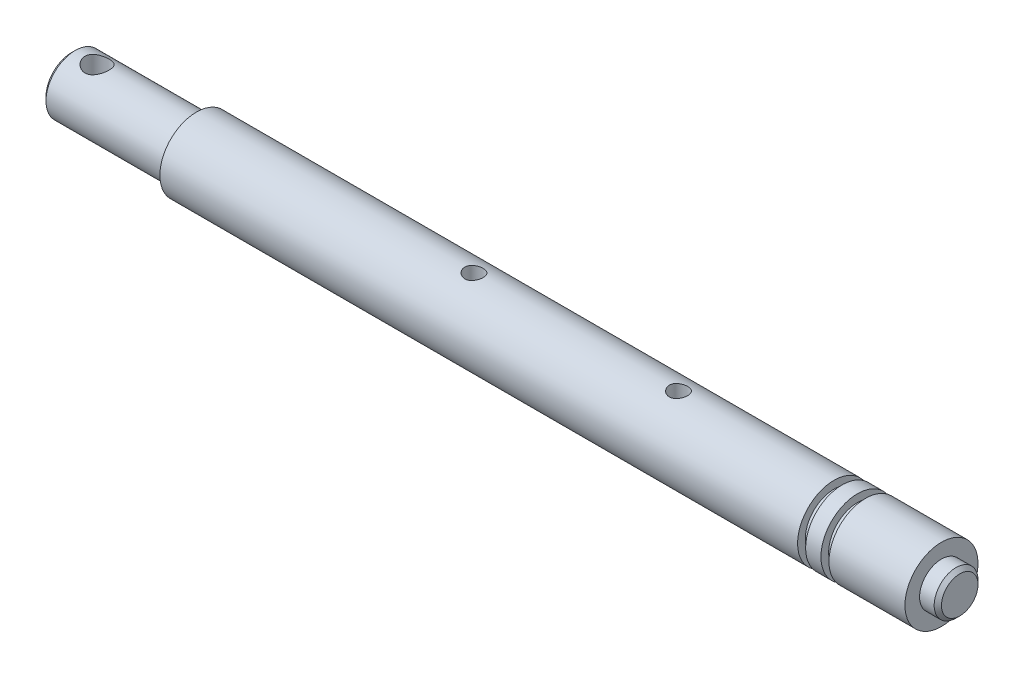
from build123d import *

# Parameters (mm, degrees)
SKETCH_1_R          = 4
EXTRUDE_1_DEPTH     = 17.1
SKETCH_2_R          = 5
EXTRUDE_2_DEPTH     = 102
SKETCH_3_R          = 1.65
CUT_EXTRUDE_1_DEPTH = 20
CUT_EXTRUDE_START   = -6.8
SKETCH_7_R          = 5
SKETCH_7_R_2        = 3.95
CUT_EXTRUDE_4_DEPTH = 1.1
SKETCH_8_R          = 3
EXTRUDE_3_DEPTH     = 2.5
CHAMFER_1_SIZE      = 0.5
SKETCH_9_R          = 1.25
CUT_EXTRUDE_5_DEPTH = 7
CUT_EXTRUDE_START_2 = -10
SKETCH_7_2_R        = 5
SKETCH_7_2_R_2      = 3.95
CUT_EXTRUDE_6_DEPTH = 1.1


with BuildPart() as part:
    # 草图1 → 凸台-拉伸1 (new body)
    with BuildSketch(Plane(origin=(0, 0, 0), x_dir=(0, 0, -1), z_dir=(1, 0, 0))):
        Circle(SKETCH_1_R)
    extrude(amount=EXTRUDE_1_DEPTH)

    # 草图2 → 凸台-拉伸2 (add)
    with BuildSketch(Plane(origin=(17.1, 0, 0), x_dir=(0, 0, -1), z_dir=(1, 0, 0))):
        with Locations(Location((0, 0, 0), (0, 0, 270))):
            Circle(SKETCH_2_R)
    extrude(amount=EXTRUDE_2_DEPTH)

    # 草图3 → 切除-拉伸1 (cut)
    with BuildSketch(Plane(origin=(0, 7, 0), x_dir=(1, 0, 0), z_dir=(0, 1, 0))):
        with Locations(Location((3.5, 0, 0), (0, 0, 270))):
            Circle(SKETCH_3_R)
    extrude(amount=-CUT_EXTRUDE_1_DEPTH, mode=Mode.SUBTRACT)

    # 草图7 → 切除-拉伸4 (cut)
    with BuildSketch(Plane.ZY.offset(-97.6).offset(CUT_EXTRUDE_START)):
        Circle(SKETCH_7_R)
        Circle(SKETCH_7_R_2, mode=Mode.SUBTRACT)
    extrude(amount=-CUT_EXTRUDE_4_DEPTH, mode=Mode.SUBTRACT)

    # 草图8 → 凸台-拉伸3 (add)
    with BuildSketch(Plane(origin=(119.1, 0, 0), x_dir=(0, 0, -1), z_dir=(1, 0, 0))):
        Circle(SKETCH_8_R)
    extrude(amount=EXTRUDE_3_DEPTH)

    # 倒角1
    chamfer_1_edges = [part.edges().sort_by_distance(p)[0] for p in [
        (0, 0, 4),
        (121.6, 0, 3),
    ]]
    chamfer(chamfer_1_edges, length=CHAMFER_1_SIZE)

    # 草图9 → 切除-拉伸5 (cut)
    with BuildSketch(Plane(origin=(0, 5, 0), x_dir=(1, 0, 0), z_dir=(0, 1, 0))):
        with Locations(Location((83.1, 0, 0), (0, 0, 270))):
            Circle(SKETCH_9_R)
        with Locations(Location((55.1, 0, 0), (0, 0, 270))):
            Circle(SKETCH_9_R)
    extrude(amount=-CUT_EXTRUDE_5_DEPTH, mode=Mode.SUBTRACT)

    # 草图7<2> → 切除-拉伸6 (cut)
    with BuildSketch(Plane.ZY.offset(-97.6).offset(CUT_EXTRUDE_START_2)):
        Circle(SKETCH_7_2_R)
        Circle(SKETCH_7_2_R_2, mode=Mode.SUBTRACT)
    extrude(amount=-CUT_EXTRUDE_6_DEPTH, mode=Mode.SUBTRACT)


solid = part.part
